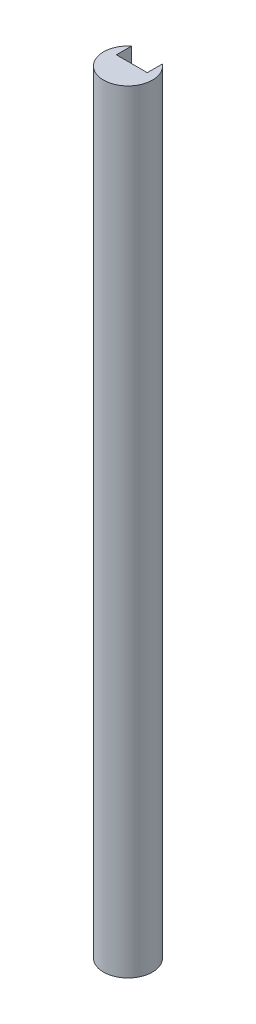
from build123d import *

# Parameters (mm, degrees)
BOSS_EXTRUDE2_DEPTH = 76.2


with BuildPart() as part:
    # Sketch1 → Boss-Extrude2 (new body)
    with BuildSketch(Plane(origin=(0, 0, 0), x_dir=(1, 0, 0), z_dir=(0, 1, 0))):
        with BuildLine():
            Line((-1.524, 1.870826823), (-1.524, 0.381))
            Line((-1.524, 0.381), (1.524, 0.381))
            Line((1.524, 0.381), (1.524, 1.870826823))
            ThreePointArc((1.524, 1.870826823), (0, -2.413), (-1.524, 1.870826823))
        make_face()
    extrude(amount=BOSS_EXTRUDE2_DEPTH)


solid = part.part
